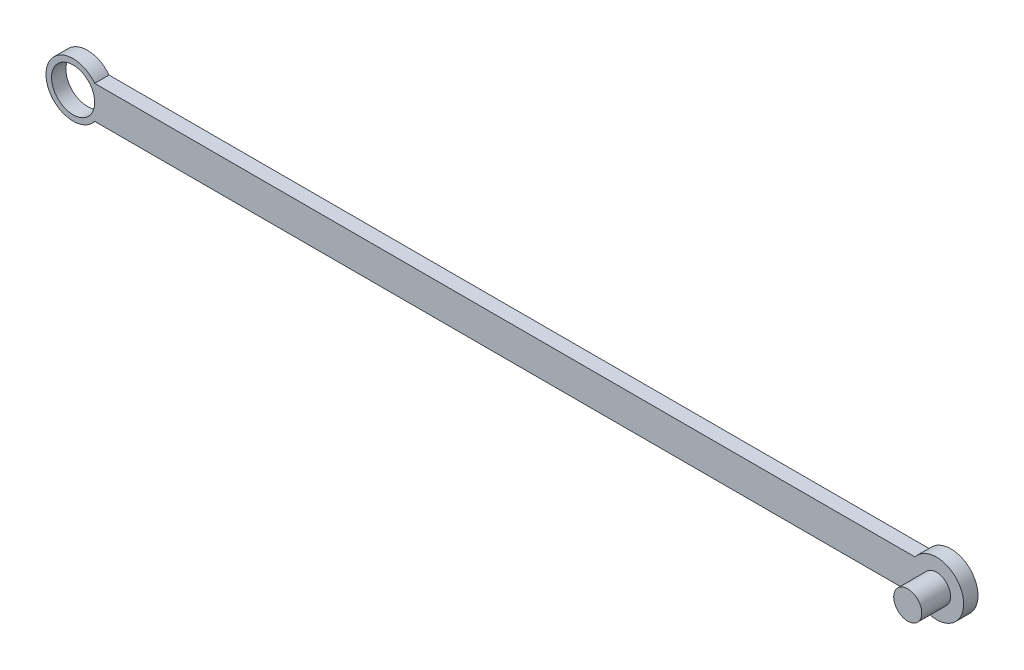
from build123d import *

# Parameters (mm, degrees)
SKETCH1_R           = 1.5
BOSS_EXTRUDE1_DEPTH = 1
SKETCH38_R          = 0.975
BOSS_EXTRUDE2_DEPTH = 2


with BuildPart() as part:
    # Sketch1 → Boss-Extrude1 (new body)
    with BuildSketch(Plane.XY):
        with BuildLine():
            Line((1.497200651, 1.14350772), (58.502799349, 1.14350772))
            ThreePointArc((58.502799349, 1.14350772), (59.164858436, 1.688714974), (60, 1.883937285))
            ThreePointArc((60, 1.883937285), (61.883937285, 0), (60, -1.883937285))
            ThreePointArc((60, -1.883937285), (59.164858436, -1.688714974), (58.502799349, -1.14350772))
            Line((58.502799349, -1.14350772), (1.497200651, -1.14350772))
            ThreePointArc((1.497200651, -1.14350772), (0.835141564, -1.688714974), (0, -1.883937285))
            ThreePointArc((0, -1.883937285), (-1.883937285, 0), (0, 1.883937285))
            ThreePointArc((0, 1.883937285), (0.835141564, 1.688714974), (1.497200651, 1.14350772))
        make_face()
        Circle(SKETCH1_R, mode=Mode.SUBTRACT)
    extrude(amount=BOSS_EXTRUDE1_DEPTH)

    # Sketch38 → Boss-Extrude2 (add)
    with BuildSketch(Plane.XY.offset(1)):
        with Locations(Location((60, 0, 0), (0, 0, 180))):
            Circle(SKETCH38_R)
    extrude(amount=BOSS_EXTRUDE2_DEPTH)


solid = part.part
